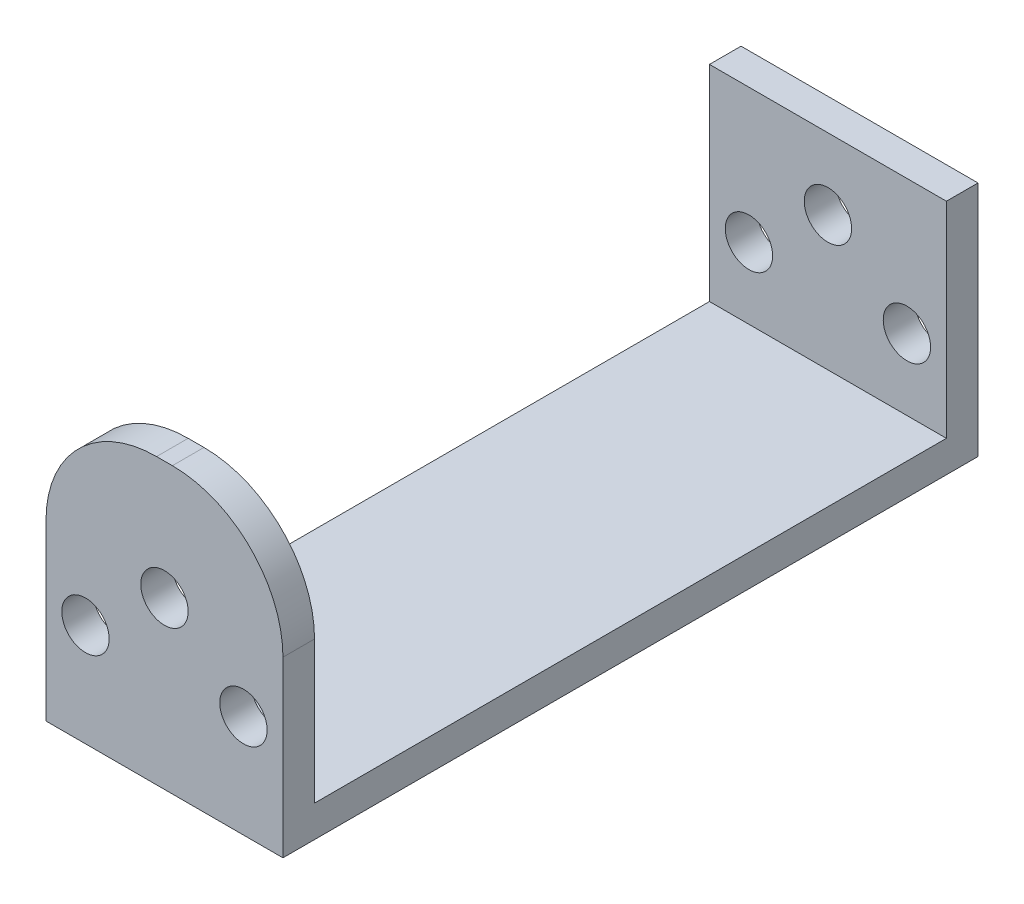
from build123d import *

# Parameters (mm, degrees)
SALIENTE_EXTRUIR1_DEPTH    = 7.5
CORTAR_EXTRUIR1_DEPTH      = 29.217902119
CORTAR_EXTRUIR1_DEPTH_BACK = 29.217902119
CROQUIS2_R                 = 1.5
REDONDEO1_R                = 7


with BuildPart() as part:
    # Croquis1 → Saliente-Extruir1 (new, symmetric)
    with BuildSketch(Plane(origin=(0, 0, 0), x_dir=(0, 0, -1), z_dir=(1, 0, 0))):
        Polygon((-22, 13), (-22, -2), (22, -2), (22, 13), (20, 13), (20, 0), (-20, 0), (-20, 13), (-20, 16), (-22, 16), align=None)
    extrude(amount=SALIENTE_EXTRUIR1_DEPTH, both=True)

    # Croquis2 → Cortar-Extruir1 (cut, two sides: drawn at the far end of the back side and taken through both)
    with BuildSketch(Plane.XY.offset(-CORTAR_EXTRUIR1_DEPTH_BACK)):
        with Locations((0, 8.5)):
            Circle(CROQUIS2_R)
        with Locations((5, 4.5)):
            Circle(CROQUIS2_R)
        with Locations((-5, 4.5)):
            Circle(CROQUIS2_R)
    extrude(amount=CORTAR_EXTRUIR1_DEPTH + CORTAR_EXTRUIR1_DEPTH_BACK, mode=Mode.SUBTRACT)

    # Redondeo1
    redondeo1_edges = [part.edges().sort_by_distance(p)[0] for p in [
        (-7.5, 16, 21),
        (7.5, 16, 21),
    ]]
    fillet(redondeo1_edges, radius=REDONDEO1_R)


solid = part.part
